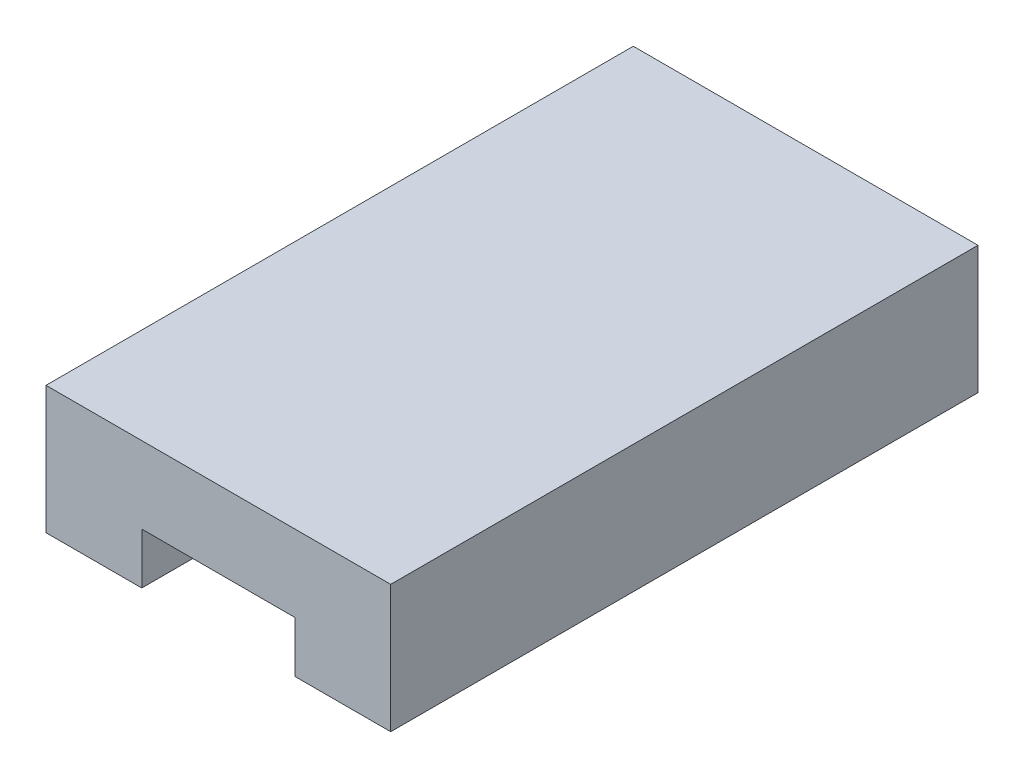
from build123d import *

# Parameters (mm, degrees)
BOSS_EXTRUDE1_DEPTH = 46


with BuildPart() as part:
    # Sketch1 → Boss-Extrude1 (new body)
    with BuildSketch(Plane.XY):
        Polygon((19.5, 0), (27, 0), (27, 10), (0, 10), (0, 0), (7.5, 0), (7.5, 4), (19.5, 4), align=None)
    extrude(amount=BOSS_EXTRUDE1_DEPTH)


solid = part.part
